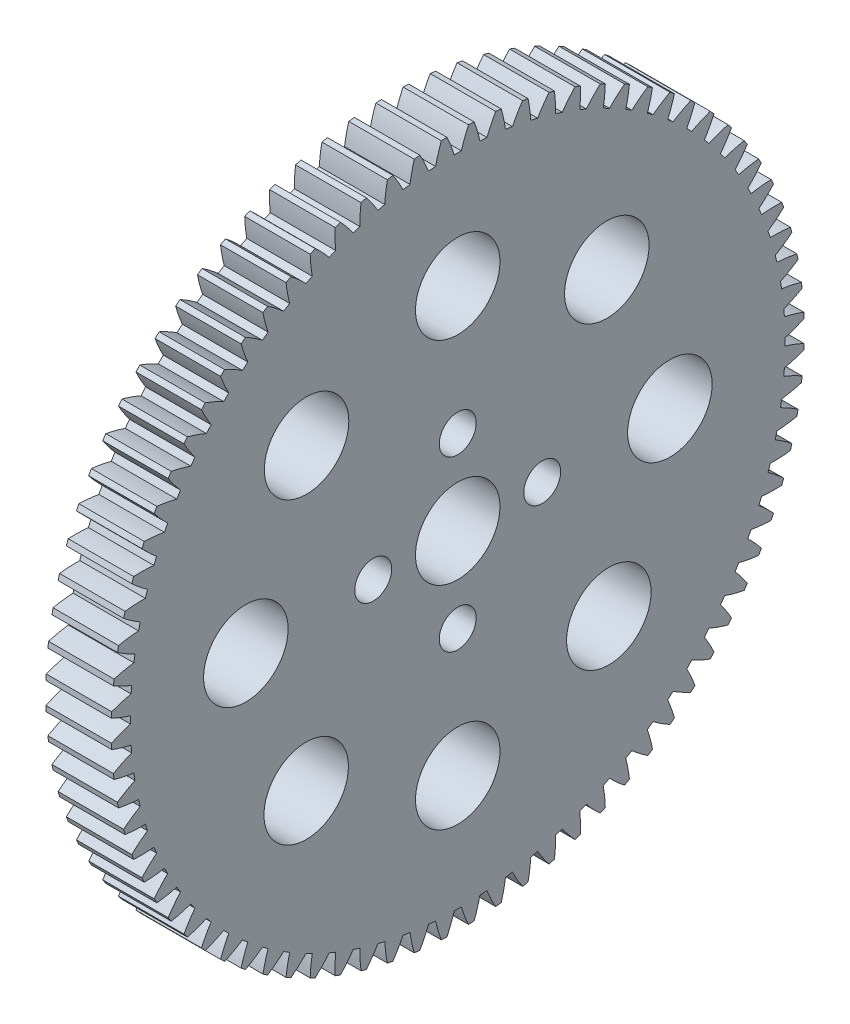
from build123d import *

# Parameters (mm, degrees)
SKETCH1_R           = 4
SKETCH1_R_2         = 1.75
BOSS_EXTRUDE1_DEPTH = 6.2


with BuildPart() as part:
    # Sketch1 → Boss-Extrude1 (new body)
    with BuildSketch(Plane(origin=(0, 0, 0), x_dir=(0, -1, 0), z_dir=(-1, 0, 0))):
        with BuildLine():
            ThreePointArc((-32.540485036, -4.117867604), (-31.611759802, -4.35271874), (-30.668071435, -4.517454533))
            ThreePointArc((-30.668071435, -4.517454533), (-30.61735087, -4.849311982), (-30.563039402, -5.180600688))
            ThreePointArc((-30.563039402, -5.180600688), (-31.409634214, -5.62888948), (-32.220331407, -6.139238063))
            ThreePointArc((-32.220331407, -6.139238063), (-32.169757197, -6.398962562), (-32.117089412, -6.658270623))
            ThreePointArc((-32.117089412, -6.658270623), (-31.17280092, -6.819530849), (-30.219096608, -6.909717881))
            ThreePointArc((-30.219096608, -6.909717881), (-30.142495162, -7.236572834), (-30.062358507, -7.562579059))
            ThreePointArc((-30.062358507, -7.562579059), (-30.871171216, -8.075908989), (-31.639327812, -8.648290907))
            ThreePointArc((-31.639327812, -8.648290907), (-31.568531756, -8.903246756), (-31.495681252, -9.15762319))
            ThreePointArc((-31.495681252, -9.15762319), (-30.541651355, -9.244298283), (-29.583811002, -9.25938052))
            ThreePointArc((-29.583811002, -9.25938052), (-29.481800949, -9.579217809), (-29.376333174, -9.897931615))
            ThreePointArc((-29.376333174, -9.897931615), (-30.142377181, -10.473137835), (-30.863257239, -11.104024162))
            ThreePointArc((-30.863257239, -11.104024162), (-30.772675818, -11.352639472), (-30.680091743, -11.600515964))
            ThreePointArc((-30.680091743, -11.600515964), (-29.722202353, -11.612071544), (-28.766131363, -11.551955999))
            ThreePointArc((-28.766131363, -11.551955999), (-28.639341628, -11.86280372), (-28.509192978, -12.172260132))
            ThreePointArc((-28.509192978, -12.172260132), (-29.227745368, -12.805796303), (-29.896904422, -13.491297415))
            ThreePointArc((-29.896904422, -13.491297415), (-29.787096101, -13.732039391), (-29.675349267, -13.9718877))
            ThreePointArc((-29.675349267, -13.9718877), (-28.719506089, -13.908252522), (-27.771098959, -13.773309829))
            ThreePointArc((-27.771098959, -13.773309829), (-27.620311243, -14.073251501), (-27.466284128, -14.371542617))
            ThreePointArc((-27.466284128, -14.371542617), (-28.132914785, -15.059502778), (-28.746227248, -15.795392334))
            ThreePointArc((-28.746227248, -15.795392334), (-28.617869032, -16.026776721), (-28.487648394, -16.257118102))
            ThreePointArc((-28.487648394, -16.257118102), (-27.53974452, -16.118684499), (-26.604848494, -15.909746623))
            ThreePointArc((-26.604848494, -15.909746623), (-26.430992455, -16.196933008), (-26.254036502, -16.482219763))
            ThreePointArc((-26.254036502, -16.482219763), (-26.864635428, -17.220362411), (-27.418320024, -18.002103406))
            ThreePointArc((-27.418320024, -18.002103406), (-27.272203284, -18.222703643), (-27.124311696, -18.442117965))
            ThreePointArc((-27.124311696, -18.442117965), (-26.190191269, -18.229739426), (-25.274570292, -17.948094538))
            ThreePointArc((-25.274570292, -17.948094538), (-25.078717809, -18.220755036), (-24.879924011, -18.491278544))
            ThreePointArc((-24.879924011, -18.491278544), (-25.430726659, -19.275052784), (-25.921369739, -20.097825525))
            ThreePointArc((-25.921369739, -20.097825525), (-25.758395333, -20.306281537), (-25.593744596, -20.513416038))
            ThreePointArc((-25.593744596, -20.513416038), (-24.679166779, -20.228401947), (-23.788465959, -19.875786483))
            ThreePointArc((-23.788465959, -19.875786483), (-23.571824528, -20.13224005), (-23.352418516, -20.386332443))
            ThreePointArc((-23.352418516, -20.386332443), (-23.840029005, -21.210906046), (-24.26460559, -22.069637866))
            ThreePointArc((-24.26460559, -22.069637866), (-24.085778309, -22.264664453), (-23.905383551, -22.458242079))
            ThreePointArc((-23.905383551, -22.458242079), (-23.015987019, -22.102349643), (-22.155697823, -21.680937594))
            ThreePointArc((-22.155697823, -21.680937594), (-21.91960311, -21.91960311), (-21.680937594, -22.155697823))
            ThreePointArc((-21.680937594, -22.155697823), (-22.102349643, -23.015987019), (-22.458242079, -23.905383551))
            ThreePointArc((-22.458242079, -23.905383551), (-22.264664453, -24.085778309), (-22.069637866, -24.26460559))
            ThreePointArc((-22.069637866, -24.26460559), (-21.210906046, -23.840029005), (-20.386332443, -23.352418516))
            ThreePointArc((-20.386332443, -23.352418516), (-20.13224005, -23.571824528), (-19.875786483, -23.788465959))
            ThreePointArc((-19.875786483, -23.788465959), (-20.228401947, -24.679166779), (-20.513416038, -25.593744596))
            ThreePointArc((-20.513416038, -25.593744596), (-20.306281537, -25.758395333), (-20.097825525, -25.921369739))
            ThreePointArc((-20.097825525, -25.921369739), (-19.275052784, -25.430726659), (-18.491278544, -24.879924011))
            ThreePointArc((-18.491278544, -24.879924011), (-18.220755036, -25.078717809), (-17.948094538, -25.274570292))
            ThreePointArc((-17.948094538, -25.274570292), (-18.229739426, -26.190191269), (-18.442117965, -27.124311696))
            ThreePointArc((-18.442117965, -27.124311696), (-18.222703643, -27.272203284), (-18.002103406, -27.418320024))
            ThreePointArc((-18.002103406, -27.418320024), (-17.220362411, -26.864635428), (-16.482219763, -26.254036502))
            ThreePointArc((-16.482219763, -26.254036502), (-16.196933008, -26.430992455), (-15.909746623, -26.604848494))
            ThreePointArc((-15.909746623, -26.604848494), (-16.118684499, -27.53974452), (-16.257118102, -28.487648394))
            ThreePointArc((-16.257118102, -28.487648394), (-16.026776721, -28.617869032), (-15.795392334, -28.746227248))
            ThreePointArc((-15.795392334, -28.746227248), (-15.059502778, -28.132914785), (-14.371542617, -27.466284128))
            ThreePointArc((-14.371542617, -27.466284128), (-14.073251501, -27.620311243), (-13.773309829, -27.771098959))
            ThreePointArc((-13.773309829, -27.771098959), (-13.908252522, -28.719506089), (-13.9718877, -29.675349267))
            ThreePointArc((-13.9718877, -29.675349267), (-13.732039391, -29.787096101), (-13.491297415, -29.896904422))
            ThreePointArc((-13.491297415, -29.896904422), (-12.805796303, -29.227745368), (-12.172260132, -28.509192978))
            ThreePointArc((-12.172260132, -28.509192978), (-11.86280372, -28.639341628), (-11.551955999, -28.766131363))
            ThreePointArc((-11.551955999, -28.766131363), (-11.612071544, -29.722202353), (-11.600515964, -30.680091743))
            ThreePointArc((-11.600515964, -30.680091743), (-11.352639472, -30.772675818), (-11.104024162, -30.863257239))
            ThreePointArc((-11.104024162, -30.863257239), (-10.473137835, -30.142377181), (-9.897931615, -29.376333174))
            ThreePointArc((-9.897931615, -29.376333174), (-9.579217809, -29.481800949), (-9.25938052, -29.583811002))
            ThreePointArc((-9.25938052, -29.583811002), (-9.244298283, -30.541651355), (-9.15762319, -31.495681252))
            ThreePointArc((-9.15762319, -31.495681252), (-8.903246756, -31.568531756), (-8.648290907, -31.639327812))
            ThreePointArc((-8.648290907, -31.639327812), (-8.075908989, -30.871171216), (-7.562579059, -30.062358507))
            ThreePointArc((-7.562579059, -30.062358507), (-7.236572834, -30.142495162), (-6.909717881, -30.219096608))
            ThreePointArc((-6.909717881, -30.219096608), (-6.819530849, -31.17280092), (-6.658270623, -32.117089412))
            ThreePointArc((-6.658270623, -32.117089412), (-6.398962562, -32.169757197), (-6.139238063, -32.220331407))
            ThreePointArc((-6.139238063, -32.220331407), (-5.62888948, -31.409634214), (-5.180600688, -30.563039402))
            ThreePointArc((-5.180600688, -30.563039402), (-4.849311982, -30.61735087), (-4.517454533, -30.668071435))
            ThreePointArc((-4.517454533, -30.668071435), (-4.35271874, -31.611759802), (-4.117867604, -32.540485036))
            ThreePointArc((-4.117867604, -32.540485036), (-3.855226637, -32.572645388), (-3.592334775, -32.602685946))
            ThreePointArc((-3.592334775, -32.602685946), (-3.147165994, -31.754446373), (-2.76668219, -30.875288997))
            ThreePointArc((-2.76668219, -30.875288997), (-2.432153508, -30.903440428), (-2.097339576, -30.927967403))
            ThreePointArc((-2.097339576, -30.927967403), (-1.859070673, -31.855821673), (-1.552076562, -32.763257749))
            ThreePointArc((-1.552076562, -32.763257749), (-1.287721957, -32.774712389), (-1.023283548, -32.784034083))
            ThreePointArc((-1.023283548, -32.784034083), (-0.646039184, -31.90348181), (-0.335706178, -30.997182168))
            ThreePointArc((-0.335706178, -30.997182168), (0, -30.999), (0.335706178, -30.997182168))
            ThreePointArc((0.335706178, -30.997182168), (0.646039184, -31.90348181), (1.023283548, -32.784034083))
            ThreePointArc((1.023283548, -32.784034083), (1.287721957, -32.774712389), (1.552076562, -32.763257749))
            ThreePointArc((1.552076562, -32.763257749), (1.859070673, -31.855821673), (2.097339576, -30.927967403))
            ThreePointArc((2.097339576, -30.927967403), (2.432153508, -30.903440428), (2.76668219, -30.875288997))
            ThreePointArc((2.76668219, -30.875288997), (3.147165994, -31.754446373), (3.592334775, -32.602685946))
            ThreePointArc((3.592334775, -32.602685946), (3.855226637, -32.572645388), (4.117867604, -32.540485036))
            ThreePointArc((4.117867604, -32.540485036), (4.35271874, -31.611759802), (4.517454533, -30.668071435))
            ThreePointArc((4.517454533, -30.668071435), (4.849311982, -30.61735087), (5.180600688, -30.563039402))
            ThreePointArc((5.180600688, -30.563039402), (5.62888948, -31.409634214), (6.139238063, -32.220331407))
            ThreePointArc((6.139238063, -32.220331407), (6.398962562, -32.169757197), (6.658270623, -32.117089412))
            ThreePointArc((6.658270623, -32.117089412), (6.819530849, -31.17280092), (6.909717881, -30.219096608))
            ThreePointArc((6.909717881, -30.219096608), (7.236572834, -30.142495162), (7.562579059, -30.062358507))
            ThreePointArc((7.562579059, -30.062358507), (8.075908989, -30.871171216), (8.648290907, -31.639327812))
            ThreePointArc((8.648290907, -31.639327812), (8.903246756, -31.568531756), (9.15762319, -31.495681252))
            ThreePointArc((9.15762319, -31.495681252), (9.244298283, -30.541651355), (9.25938052, -29.583811002))
            ThreePointArc((9.25938052, -29.583811002), (9.579217809, -29.481800949), (9.897931615, -29.376333174))
            ThreePointArc((9.897931615, -29.376333174), (10.473137835, -30.142377181), (11.104024162, -30.863257239))
            ThreePointArc((11.104024162, -30.863257239), (11.352639472, -30.772675818), (11.600515964, -30.680091743))
            ThreePointArc((11.600515964, -30.680091743), (11.612071544, -29.722202353), (11.551955999, -28.766131363))
            ThreePointArc((11.551955999, -28.766131363), (11.86280372, -28.639341628), (12.172260132, -28.509192978))
            ThreePointArc((12.172260132, -28.509192978), (12.805796303, -29.227745368), (13.491297415, -29.896904422))
            ThreePointArc((13.491297415, -29.896904422), (13.732039391, -29.787096101), (13.9718877, -29.675349267))
            ThreePointArc((13.9718877, -29.675349267), (13.908252522, -28.719506089), (13.773309829, -27.771098959))
            ThreePointArc((13.773309829, -27.771098959), (14.073251501, -27.620311243), (14.371542617, -27.466284128))
            ThreePointArc((14.371542617, -27.466284128), (15.059502778, -28.132914785), (15.795392334, -28.746227248))
            ThreePointArc((15.795392334, -28.746227248), (16.026776721, -28.617869032), (16.257118102, -28.487648394))
            ThreePointArc((16.257118102, -28.487648394), (16.118684499, -27.53974452), (15.909746623, -26.604848494))
            ThreePointArc((15.909746623, -26.604848494), (16.196933008, -26.430992455), (16.482219763, -26.254036502))
            ThreePointArc((16.482219763, -26.254036502), (17.220362411, -26.864635428), (18.002103406, -27.418320024))
            ThreePointArc((18.002103406, -27.418320024), (18.222703643, -27.272203284), (18.442117965, -27.124311696))
            ThreePointArc((18.442117965, -27.124311696), (18.229739426, -26.190191269), (17.948094538, -25.274570292))
            ThreePointArc((17.948094538, -25.274570292), (18.220755036, -25.078717809), (18.491278544, -24.879924011))
            ThreePointArc((18.491278544, -24.879924011), (19.275052784, -25.430726659), (20.097825525, -25.921369739))
            ThreePointArc((20.097825525, -25.921369739), (20.306281537, -25.758395333), (20.513416038, -25.593744596))
            ThreePointArc((20.513416038, -25.593744596), (20.228401947, -24.679166779), (19.875786483, -23.788465959))
            ThreePointArc((19.875786483, -23.788465959), (20.13224005, -23.571824528), (20.386332443, -23.352418516))
            ThreePointArc((20.386332443, -23.352418516), (21.210906046, -23.840029005), (22.069637866, -24.26460559))
            ThreePointArc((22.069637866, -24.26460559), (22.264664453, -24.085778309), (22.458242079, -23.905383551))
            ThreePointArc((22.458242079, -23.905383551), (22.102349643, -23.015987019), (21.680937594, -22.155697823))
            ThreePointArc((21.680937594, -22.155697823), (21.91960311, -21.91960311), (22.155697823, -21.680937594))
            ThreePointArc((22.155697823, -21.680937594), (23.015987019, -22.102349643), (23.905383551, -22.458242079))
            ThreePointArc((23.905383551, -22.458242079), (24.085778309, -22.264664453), (24.26460559, -22.069637866))
            ThreePointArc((24.26460559, -22.069637866), (23.840029005, -21.210906046), (23.352418516, -20.386332443))
            ThreePointArc((23.352418516, -20.386332443), (23.571824528, -20.13224005), (23.788465959, -19.875786483))
            ThreePointArc((23.788465959, -19.875786483), (24.679166779, -20.228401947), (25.593744596, -20.513416038))
            ThreePointArc((25.593744596, -20.513416038), (25.758395333, -20.306281537), (25.921369739, -20.097825525))
            ThreePointArc((25.921369739, -20.097825525), (25.430726659, -19.275052784), (24.879924011, -18.491278544))
            ThreePointArc((24.879924011, -18.491278544), (25.078717809, -18.220755036), (25.274570292, -17.948094538))
            ThreePointArc((25.274570292, -17.948094538), (26.190191269, -18.229739426), (27.124311696, -18.442117965))
            ThreePointArc((27.124311696, -18.442117965), (27.272203284, -18.222703643), (27.418320024, -18.002103406))
            ThreePointArc((27.418320024, -18.002103406), (26.864635428, -17.220362411), (26.254036502, -16.482219763))
            ThreePointArc((26.254036502, -16.482219763), (26.430992455, -16.196933008), (26.604848494, -15.909746623))
            ThreePointArc((26.604848494, -15.909746623), (27.53974452, -16.118684499), (28.487648394, -16.257118102))
            ThreePointArc((28.487648394, -16.257118102), (28.617869032, -16.026776721), (28.746227248, -15.795392334))
            ThreePointArc((28.746227248, -15.795392334), (28.132914785, -15.059502778), (27.466284128, -14.371542617))
            ThreePointArc((27.466284128, -14.371542617), (27.620311243, -14.073251501), (27.771098959, -13.773309829))
            ThreePointArc((27.771098959, -13.773309829), (28.719506089, -13.908252522), (29.675349267, -13.9718877))
            ThreePointArc((29.675349267, -13.9718877), (29.787096101, -13.732039391), (29.896904422, -13.491297415))
            ThreePointArc((29.896904422, -13.491297415), (29.227745368, -12.805796303), (28.509192978, -12.172260132))
            ThreePointArc((28.509192978, -12.172260132), (28.639341628, -11.86280372), (28.766131363, -11.551955999))
            ThreePointArc((28.766131363, -11.551955999), (29.722202353, -11.612071544), (30.680091743, -11.600515964))
            ThreePointArc((30.680091743, -11.600515964), (30.772675818, -11.352639472), (30.863257239, -11.104024162))
            ThreePointArc((30.863257239, -11.104024162), (30.142377181, -10.473137835), (29.376333174, -9.897931615))
            ThreePointArc((29.376333174, -9.897931615), (29.481800949, -9.579217809), (29.583811002, -9.25938052))
            ThreePointArc((29.583811002, -9.25938052), (30.541651355, -9.244298283), (31.495681252, -9.15762319))
            ThreePointArc((31.495681252, -9.15762319), (31.568531756, -8.903246756), (31.639327812, -8.648290907))
            ThreePointArc((31.639327812, -8.648290907), (30.871171216, -8.075908989), (30.062358507, -7.562579059))
            ThreePointArc((30.062358507, -7.562579059), (30.142495162, -7.236572834), (30.219096608, -6.909717881))
            ThreePointArc((30.219096608, -6.909717881), (31.17280092, -6.819530849), (32.117089412, -6.658270623))
            ThreePointArc((32.117089412, -6.658270623), (32.169757197, -6.398962562), (32.220331407, -6.139238063))
            ThreePointArc((32.220331407, -6.139238063), (31.409634214, -5.62888948), (30.563039402, -5.180600688))
            ThreePointArc((30.563039402, -5.180600688), (30.61735087, -4.849311982), (30.668071435, -4.517454533))
            ThreePointArc((30.668071435, -4.517454533), (31.611759802, -4.35271874), (32.540485036, -4.117867604))
            ThreePointArc((32.540485036, -4.117867604), (32.572645388, -3.855226637), (32.602685946, -3.592334775))
            ThreePointArc((32.602685946, -3.592334775), (31.754446373, -3.147165994), (30.875288997, -2.76668219))
            ThreePointArc((30.875288997, -2.76668219), (30.903440428, -2.432153508), (30.927967403, -2.097339576))
            ThreePointArc((30.927967403, -2.097339576), (31.855821673, -1.859070673), (32.763257749, -1.552076562))
            ThreePointArc((32.763257749, -1.552076562), (32.774712389, -1.287721957), (32.784034083, -1.023283548))
            ThreePointArc((32.784034083, -1.023283548), (31.90348181, -0.646039184), (30.997182168, -0.335706178))
            ThreePointArc((30.997182168, -0.335706178), (30.999, 0), (30.997182168, 0.335706178))
            ThreePointArc((30.997182168, 0.335706178), (31.90348181, 0.646039184), (32.784034083, 1.023283548))
            ThreePointArc((32.784034083, 1.023283548), (32.774712389, 1.287721957), (32.763257749, 1.552076562))
            ThreePointArc((32.763257749, 1.552076562), (31.855821673, 1.859070673), (30.927967403, 2.097339576))
            ThreePointArc((30.927967403, 2.097339576), (30.903440428, 2.432153508), (30.875288997, 2.76668219))
            ThreePointArc((30.875288997, 2.76668219), (31.754446373, 3.147165994), (32.602685946, 3.592334775))
            ThreePointArc((32.602685946, 3.592334775), (32.572645388, 3.855226637), (32.540485036, 4.117867604))
            ThreePointArc((32.540485036, 4.117867604), (31.611759802, 4.35271874), (30.668071435, 4.517454533))
            ThreePointArc((30.668071435, 4.517454533), (30.61735087, 4.849311982), (30.563039402, 5.180600688))
            ThreePointArc((30.563039402, 5.180600688), (31.409634214, 5.62888948), (32.220331407, 6.139238063))
            ThreePointArc((32.220331407, 6.139238063), (32.169757197, 6.398962562), (32.117089412, 6.658270623))
            ThreePointArc((32.117089412, 6.658270623), (31.17280092, 6.819530849), (30.219096608, 6.909717881))
            ThreePointArc((30.219096608, 6.909717881), (30.142495162, 7.236572834), (30.062358507, 7.562579059))
            ThreePointArc((30.062358507, 7.562579059), (30.871171216, 8.075908989), (31.639327812, 8.648290907))
            ThreePointArc((31.639327812, 8.648290907), (31.568531756, 8.903246756), (31.495681252, 9.15762319))
            ThreePointArc((31.495681252, 9.15762319), (30.541651355, 9.244298283), (29.583811002, 9.25938052))
            ThreePointArc((29.583811002, 9.25938052), (29.481800949, 9.579217809), (29.376333174, 9.897931615))
            ThreePointArc((29.376333174, 9.897931615), (30.142377181, 10.473137835), (30.863257239, 11.104024162))
            ThreePointArc((30.863257239, 11.104024162), (30.772675818, 11.352639472), (30.680091743, 11.600515964))
            ThreePointArc((30.680091743, 11.600515964), (29.722202353, 11.612071544), (28.766131363, 11.551955999))
            ThreePointArc((28.766131363, 11.551955999), (28.639341628, 11.86280372), (28.509192978, 12.172260132))
            ThreePointArc((28.509192978, 12.172260132), (29.227745368, 12.805796303), (29.896904422, 13.491297415))
            ThreePointArc((29.896904422, 13.491297415), (29.787096101, 13.732039391), (29.675349267, 13.9718877))
            ThreePointArc((29.675349267, 13.9718877), (28.719506089, 13.908252522), (27.771098959, 13.773309829))
            ThreePointArc((27.771098959, 13.773309829), (27.620311243, 14.073251501), (27.466284128, 14.371542617))
            ThreePointArc((27.466284128, 14.371542617), (28.132914785, 15.059502778), (28.746227248, 15.795392334))
            ThreePointArc((28.746227248, 15.795392334), (28.617869032, 16.026776721), (28.487648394, 16.257118102))
            ThreePointArc((28.487648394, 16.257118102), (27.53974452, 16.118684499), (26.604848494, 15.909746623))
            ThreePointArc((26.604848494, 15.909746623), (26.430992455, 16.196933008), (26.254036502, 16.482219763))
            ThreePointArc((26.254036502, 16.482219763), (26.864635428, 17.220362411), (27.418320024, 18.002103406))
            ThreePointArc((27.418320024, 18.002103406), (27.272203284, 18.222703643), (27.124311696, 18.442117965))
            ThreePointArc((27.124311696, 18.442117965), (26.190191269, 18.229739426), (25.274570292, 17.948094538))
            ThreePointArc((25.274570292, 17.948094538), (25.078717809, 18.220755036), (24.879924011, 18.491278544))
            ThreePointArc((24.879924011, 18.491278544), (25.430726659, 19.275052784), (25.921369739, 20.097825525))
            ThreePointArc((25.921369739, 20.097825525), (25.758395333, 20.306281537), (25.593744596, 20.513416038))
            ThreePointArc((25.593744596, 20.513416038), (24.679166779, 20.228401947), (23.788465959, 19.875786483))
            ThreePointArc((23.788465959, 19.875786483), (23.571824528, 20.13224005), (23.352418516, 20.386332443))
            ThreePointArc((23.352418516, 20.386332443), (23.840029005, 21.210906046), (24.26460559, 22.069637866))
            ThreePointArc((24.26460559, 22.069637866), (24.085778309, 22.264664453), (23.905383551, 22.458242079))
            ThreePointArc((23.905383551, 22.458242079), (23.015987019, 22.102349643), (22.155697823, 21.680937594))
            ThreePointArc((22.155697823, 21.680937594), (21.91960311, 21.91960311), (21.680937594, 22.155697823))
            ThreePointArc((21.680937594, 22.155697823), (22.102349643, 23.015987019), (22.458242079, 23.905383551))
            ThreePointArc((22.458242079, 23.905383551), (22.264664453, 24.085778309), (22.069637866, 24.26460559))
            ThreePointArc((22.069637866, 24.26460559), (21.210906046, 23.840029005), (20.386332443, 23.352418516))
            ThreePointArc((20.386332443, 23.352418516), (20.13224005, 23.571824528), (19.875786483, 23.788465959))
            ThreePointArc((19.875786483, 23.788465959), (20.228401947, 24.679166779), (20.513416038, 25.593744596))
            ThreePointArc((20.513416038, 25.593744596), (20.306281537, 25.758395333), (20.097825525, 25.921369739))
            ThreePointArc((20.097825525, 25.921369739), (19.275052784, 25.430726659), (18.491278544, 24.879924011))
            ThreePointArc((18.491278544, 24.879924011), (18.220755036, 25.078717809), (17.948094538, 25.274570292))
            ThreePointArc((17.948094538, 25.274570292), (18.229739426, 26.190191269), (18.442117965, 27.124311696))
            ThreePointArc((18.442117965, 27.124311696), (18.222703643, 27.272203284), (18.002103406, 27.418320024))
            ThreePointArc((18.002103406, 27.418320024), (17.220362411, 26.864635428), (16.482219763, 26.254036502))
            ThreePointArc((16.482219763, 26.254036502), (16.196933008, 26.430992455), (15.909746623, 26.604848494))
            ThreePointArc((15.909746623, 26.604848494), (16.118684499, 27.53974452), (16.257118102, 28.487648394))
            ThreePointArc((16.257118102, 28.487648394), (16.026776721, 28.617869032), (15.795392334, 28.746227248))
            ThreePointArc((15.795392334, 28.746227248), (15.059502778, 28.132914785), (14.371542617, 27.466284128))
            ThreePointArc((14.371542617, 27.466284128), (14.073251501, 27.620311243), (13.773309829, 27.771098959))
            ThreePointArc((13.773309829, 27.771098959), (13.908252522, 28.719506089), (13.9718877, 29.675349267))
            ThreePointArc((13.9718877, 29.675349267), (13.732039391, 29.787096101), (13.491297415, 29.896904422))
            ThreePointArc((13.491297415, 29.896904422), (12.805796303, 29.227745368), (12.172260132, 28.509192978))
            ThreePointArc((12.172260132, 28.509192978), (11.86280372, 28.639341628), (11.551955999, 28.766131363))
            ThreePointArc((11.551955999, 28.766131363), (11.612071544, 29.722202353), (11.600515964, 30.680091743))
            ThreePointArc((11.600515964, 30.680091743), (11.352639472, 30.772675818), (11.104024162, 30.863257239))
            ThreePointArc((11.104024162, 30.863257239), (10.473137835, 30.142377181), (9.897931615, 29.376333174))
            ThreePointArc((9.897931615, 29.376333174), (9.579217809, 29.481800949), (9.25938052, 29.583811002))
            ThreePointArc((9.25938052, 29.583811002), (9.244298283, 30.541651355), (9.15762319, 31.495681252))
            ThreePointArc((9.15762319, 31.495681252), (8.903246756, 31.568531756), (8.648290907, 31.639327812))
            ThreePointArc((8.648290907, 31.639327812), (8.075908989, 30.871171216), (7.562579059, 30.062358507))
            ThreePointArc((7.562579059, 30.062358507), (7.236572834, 30.142495162), (6.909717881, 30.219096608))
            ThreePointArc((6.909717881, 30.219096608), (6.819530849, 31.17280092), (6.658270623, 32.117089412))
            ThreePointArc((6.658270623, 32.117089412), (6.398962562, 32.169757197), (6.139238063, 32.220331407))
            ThreePointArc((6.139238063, 32.220331407), (5.62888948, 31.409634214), (5.180600688, 30.563039402))
            ThreePointArc((5.180600688, 30.563039402), (4.849311982, 30.61735087), (4.517454533, 30.668071435))
            ThreePointArc((4.517454533, 30.668071435), (4.35271874, 31.611759802), (4.117867604, 32.540485036))
            ThreePointArc((4.117867604, 32.540485036), (3.855226637, 32.572645388), (3.592334775, 32.602685946))
            ThreePointArc((3.592334775, 32.602685946), (3.147165994, 31.754446373), (2.76668219, 30.875288997))
            ThreePointArc((2.76668219, 30.875288997), (2.432153508, 30.903440428), (2.097339576, 30.927967403))
            ThreePointArc((2.097339576, 30.927967403), (1.859070673, 31.855821673), (1.552076562, 32.763257749))
            ThreePointArc((1.552076562, 32.763257749), (1.287721957, 32.774712389), (1.023283548, 32.784034083))
            ThreePointArc((1.023283548, 32.784034083), (0.646039184, 31.90348181), (0.335706178, 30.997182168))
            ThreePointArc((0.335706178, 30.997182168), (0, 30.999), (-0.335706178, 30.997182168))
            ThreePointArc((-0.335706178, 30.997182168), (-0.646039184, 31.90348181), (-1.023283548, 32.784034083))
            ThreePointArc((-1.023283548, 32.784034083), (-1.287721957, 32.774712389), (-1.552076562, 32.763257749))
            ThreePointArc((-1.552076562, 32.763257749), (-1.859070673, 31.855821673), (-2.097339576, 30.927967403))
            ThreePointArc((-2.097339576, 30.927967403), (-2.432153508, 30.903440428), (-2.76668219, 30.875288997))
            ThreePointArc((-2.76668219, 30.875288997), (-3.147165994, 31.754446373), (-3.592334775, 32.602685946))
            ThreePointArc((-3.592334775, 32.602685946), (-3.855226637, 32.572645388), (-4.117867604, 32.540485036))
            ThreePointArc((-4.117867604, 32.540485036), (-4.35271874, 31.611759802), (-4.517454533, 30.668071435))
            ThreePointArc((-4.517454533, 30.668071435), (-4.849311982, 30.61735087), (-5.180600688, 30.563039402))
            ThreePointArc((-5.180600688, 30.563039402), (-5.62888948, 31.409634214), (-6.139238063, 32.220331407))
            ThreePointArc((-6.139238063, 32.220331407), (-6.398962562, 32.169757197), (-6.658270623, 32.117089412))
            ThreePointArc((-6.658270623, 32.117089412), (-6.819530849, 31.17280092), (-6.909717881, 30.219096608))
            ThreePointArc((-6.909717881, 30.219096608), (-7.236572834, 30.142495162), (-7.562579059, 30.062358507))
            ThreePointArc((-7.562579059, 30.062358507), (-8.075908989, 30.871171216), (-8.648290907, 31.639327812))
            ThreePointArc((-8.648290907, 31.639327812), (-8.903246756, 31.568531756), (-9.15762319, 31.495681252))
            ThreePointArc((-9.15762319, 31.495681252), (-9.244298283, 30.541651355), (-9.25938052, 29.583811002))
            ThreePointArc((-9.25938052, 29.583811002), (-9.579217809, 29.481800949), (-9.897931615, 29.376333174))
            ThreePointArc((-9.897931615, 29.376333174), (-10.473137835, 30.142377181), (-11.104024162, 30.863257239))
            ThreePointArc((-11.104024162, 30.863257239), (-11.352639472, 30.772675818), (-11.600515964, 30.680091743))
            ThreePointArc((-11.600515964, 30.680091743), (-11.612071544, 29.722202353), (-11.551955999, 28.766131363))
            ThreePointArc((-11.551955999, 28.766131363), (-11.86280372, 28.639341628), (-12.172260132, 28.509192978))
            ThreePointArc((-12.172260132, 28.509192978), (-12.805796303, 29.227745368), (-13.491297415, 29.896904422))
            ThreePointArc((-13.491297415, 29.896904422), (-13.732039391, 29.787096101), (-13.9718877, 29.675349267))
            ThreePointArc((-13.9718877, 29.675349267), (-13.908252522, 28.719506089), (-13.773309829, 27.771098959))
            ThreePointArc((-13.773309829, 27.771098959), (-14.073251501, 27.620311243), (-14.371542617, 27.466284128))
            ThreePointArc((-14.371542617, 27.466284128), (-15.059502778, 28.132914785), (-15.795392334, 28.746227248))
            ThreePointArc((-15.795392334, 28.746227248), (-16.026776721, 28.617869032), (-16.257118102, 28.487648394))
            ThreePointArc((-16.257118102, 28.487648394), (-16.118684499, 27.53974452), (-15.909746623, 26.604848494))
            ThreePointArc((-15.909746623, 26.604848494), (-16.196933008, 26.430992455), (-16.482219763, 26.254036502))
            ThreePointArc((-16.482219763, 26.254036502), (-17.220362411, 26.864635428), (-18.002103406, 27.418320024))
            ThreePointArc((-18.002103406, 27.418320024), (-18.222703643, 27.272203284), (-18.442117965, 27.124311696))
            ThreePointArc((-18.442117965, 27.124311696), (-18.229739426, 26.190191269), (-17.948094538, 25.274570292))
            ThreePointArc((-17.948094538, 25.274570292), (-18.220755036, 25.078717809), (-18.491278544, 24.879924011))
            ThreePointArc((-18.491278544, 24.879924011), (-19.275052784, 25.430726659), (-20.097825525, 25.921369739))
            ThreePointArc((-20.097825525, 25.921369739), (-20.306281537, 25.758395333), (-20.513416038, 25.593744596))
            ThreePointArc((-20.513416038, 25.593744596), (-20.228401947, 24.679166779), (-19.875786483, 23.788465959))
            ThreePointArc((-19.875786483, 23.788465959), (-20.13224005, 23.571824528), (-20.386332443, 23.352418516))
            ThreePointArc((-20.386332443, 23.352418516), (-21.210906046, 23.840029005), (-22.069637866, 24.26460559))
            ThreePointArc((-22.069637866, 24.26460559), (-22.264664453, 24.085778309), (-22.458242079, 23.905383551))
            ThreePointArc((-22.458242079, 23.905383551), (-22.102349643, 23.015987019), (-21.680937594, 22.155697823))
            ThreePointArc((-21.680937594, 22.155697823), (-21.91960311, 21.91960311), (-22.155697823, 21.680937594))
            ThreePointArc((-22.155697823, 21.680937594), (-23.015987019, 22.102349643), (-23.905383551, 22.458242079))
            ThreePointArc((-23.905383551, 22.458242079), (-24.085778309, 22.264664453), (-24.26460559, 22.069637866))
            ThreePointArc((-24.26460559, 22.069637866), (-23.840029005, 21.210906046), (-23.352418516, 20.386332443))
            ThreePointArc((-23.352418516, 20.386332443), (-23.571824528, 20.13224005), (-23.788465959, 19.875786483))
            ThreePointArc((-23.788465959, 19.875786483), (-24.679166779, 20.228401947), (-25.593744596, 20.513416038))
            ThreePointArc((-25.593744596, 20.513416038), (-25.758395333, 20.306281537), (-25.921369739, 20.097825525))
            ThreePointArc((-25.921369739, 20.097825525), (-25.430726659, 19.275052784), (-24.879924011, 18.491278544))
            ThreePointArc((-24.879924011, 18.491278544), (-25.078717809, 18.220755036), (-25.274570292, 17.948094538))
            ThreePointArc((-25.274570292, 17.948094538), (-26.190191269, 18.229739426), (-27.124311696, 18.442117965))
            ThreePointArc((-27.124311696, 18.442117965), (-27.272203284, 18.222703643), (-27.418320024, 18.002103406))
            ThreePointArc((-27.418320024, 18.002103406), (-26.864635428, 17.220362411), (-26.254036502, 16.482219763))
            ThreePointArc((-26.254036502, 16.482219763), (-26.430992455, 16.196933008), (-26.604848494, 15.909746623))
            ThreePointArc((-26.604848494, 15.909746623), (-27.53974452, 16.118684499), (-28.487648394, 16.257118102))
            ThreePointArc((-28.487648394, 16.257118102), (-28.617869032, 16.026776721), (-28.746227248, 15.795392334))
            ThreePointArc((-28.746227248, 15.795392334), (-28.132914785, 15.059502778), (-27.466284128, 14.371542617))
            ThreePointArc((-27.466284128, 14.371542617), (-27.620311243, 14.073251501), (-27.771098959, 13.773309829))
            ThreePointArc((-27.771098959, 13.773309829), (-28.719506089, 13.908252522), (-29.675349267, 13.9718877))
            ThreePointArc((-29.675349267, 13.9718877), (-29.787096101, 13.732039391), (-29.896904422, 13.491297415))
            ThreePointArc((-29.896904422, 13.491297415), (-29.227745368, 12.805796303), (-28.509192978, 12.172260132))
            ThreePointArc((-28.509192978, 12.172260132), (-28.639341628, 11.86280372), (-28.766131363, 11.551955999))
            ThreePointArc((-28.766131363, 11.551955999), (-29.722202353, 11.612071544), (-30.680091743, 11.600515964))
            ThreePointArc((-30.680091743, 11.600515964), (-30.772675818, 11.352639472), (-30.863257239, 11.104024162))
            ThreePointArc((-30.863257239, 11.104024162), (-30.142377181, 10.473137835), (-29.376333174, 9.897931615))
            ThreePointArc((-29.376333174, 9.897931615), (-29.481800949, 9.579217809), (-29.583811002, 9.25938052))
            ThreePointArc((-29.583811002, 9.25938052), (-30.541651355, 9.244298283), (-31.495681252, 9.15762319))
            ThreePointArc((-31.495681252, 9.15762319), (-31.568531756, 8.903246756), (-31.639327812, 8.648290907))
            ThreePointArc((-31.639327812, 8.648290907), (-30.871171216, 8.075908989), (-30.062358507, 7.562579059))
            ThreePointArc((-30.062358507, 7.562579059), (-30.142495162, 7.236572834), (-30.219096608, 6.909717881))
            ThreePointArc((-30.219096608, 6.909717881), (-31.17280092, 6.819530849), (-32.117089412, 6.658270623))
            ThreePointArc((-32.117089412, 6.658270623), (-32.169757197, 6.398962562), (-32.220331407, 6.139238063))
            ThreePointArc((-32.220331407, 6.139238063), (-31.409634214, 5.62888948), (-30.563039402, 5.180600688))
            ThreePointArc((-30.563039402, 5.180600688), (-30.61735087, 4.849311982), (-30.668071435, 4.517454533))
            ThreePointArc((-30.668071435, 4.517454533), (-31.611759802, 4.35271874), (-32.540485036, 4.117867604))
            ThreePointArc((-32.540485036, 4.117867604), (-32.572645388, 3.855226637), (-32.602685946, 3.592334775))
            ThreePointArc((-32.602685946, 3.592334775), (-31.754446373, 3.147165994), (-30.875288997, 2.76668219))
            ThreePointArc((-30.875288997, 2.76668219), (-30.903440428, 2.432153508), (-30.927967403, 2.097339576))
            ThreePointArc((-30.927967403, 2.097339576), (-31.855821673, 1.859070673), (-32.763257749, 1.552076562))
            ThreePointArc((-32.763257749, 1.552076562), (-32.774712389, 1.287721957), (-32.784034083, 1.023283548))
            ThreePointArc((-32.784034083, 1.023283548), (-31.90348181, 0.646039184), (-30.997182168, 0.335706178))
            ThreePointArc((-30.997182168, 0.335706178), (-30.999, 0), (-30.997182168, -0.335706178))
            ThreePointArc((-30.997182168, -0.335706178), (-31.90348181, -0.646039184), (-32.784034083, -1.023283548))
            ThreePointArc((-32.784034083, -1.023283548), (-32.774712389, -1.287721957), (-32.763257749, -1.552076562))
            ThreePointArc((-32.763257749, -1.552076562), (-31.855821673, -1.859070673), (-30.927967403, -2.097339576))
            ThreePointArc((-30.927967403, -2.097339576), (-30.903440428, -2.432153508), (-30.875288997, -2.76668219))
            ThreePointArc((-30.875288997, -2.76668219), (-31.754446373, -3.147165994), (-32.602685946, -3.592334775))
            ThreePointArc((-32.602685946, -3.592334775), (-32.572645388, -3.855226637), (-32.540485036, -4.117867604))
        make_face()
        with Locations(Location((0, 0, 0), (0, 0, 270))):
            Circle(SKETCH1_R, mode=Mode.SUBTRACT)
        with Locations(Location((0, 8, 0), (0, 0, 270))):
            Circle(SKETCH1_R_2, mode=Mode.SUBTRACT)
        with Locations(Location((-20.084034083, 0, 0), (0, 0, 270))):
            Circle(SKETCH1_R, mode=Mode.SUBTRACT)
        with Locations(Location((20.063257749, 0, 0), (0, 0, 270))):
            Circle(SKETCH1_R, mode=Mode.SUBTRACT)
        with Locations(Location((0, -20.084034083, 0), (0, 0, 270))):
            Circle(SKETCH1_R, mode=Mode.SUBTRACT)
        with Locations(Location((0, 20.063257749, 0), (0, 0, 270))):
            Circle(SKETCH1_R, mode=Mode.SUBTRACT)
        with Locations(Location((-14.36634376, -14.112602443, 0), (0, 0, 270))):
            Circle(SKETCH1_R, mode=Mode.SUBTRACT)
        with Locations(Location((14.14202094, -14.306921905, 0), (0, 0, 270))):
            Circle(SKETCH1_R, mode=Mode.SUBTRACT)
        with Locations(Location((14.135100494, 14.348299993, 0), (0, 0, 270))):
            Circle(SKETCH1_R, mode=Mode.SUBTRACT)
        with Locations(Location((-14.159703758, 14.315040904, 0), (0, 0, 270))):
            Circle(SKETCH1_R, mode=Mode.SUBTRACT)
        with Locations(Location((-8, 0, 0), (0, 0, 270))):
            Circle(SKETCH1_R_2, mode=Mode.SUBTRACT)
        with Locations(Location((8, 0, 0), (0, 0, 270))):
            Circle(SKETCH1_R_2, mode=Mode.SUBTRACT)
        with Locations(Location((0, -8, 0), (0, 0, 270))):
            Circle(SKETCH1_R_2, mode=Mode.SUBTRACT)
    extrude(amount=-BOSS_EXTRUDE1_DEPTH)


solid = part.part
